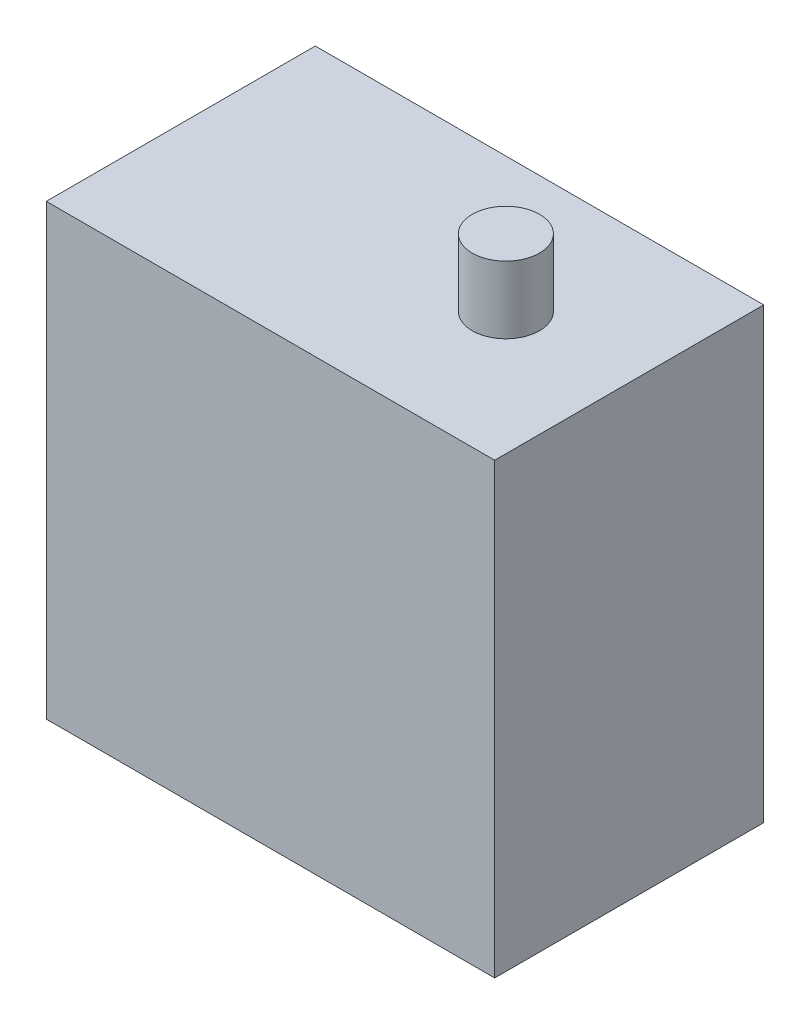
from build123d import *

# Parameters (mm, degrees)
SKETCH1_W           = 20
SKETCH1_H           = 12
BOSS_EXTRUDE1_DEPTH = 20
SKETCH2_R           = 1.5
BOSS_EXTRUDE2_DEPTH = 3


with BuildPart() as part:
    # Sketch1 → Boss-Extrude1 (new body)
    with BuildSketch(Plane(origin=(0, 0, 0), x_dir=(1, 0, 0), z_dir=(0, 1, 0))):
        Rectangle(SKETCH1_W, SKETCH1_H)
    extrude(amount=BOSS_EXTRUDE1_DEPTH)

    # Sketch2 → Boss-Extrude2 (add)
    with BuildSketch(Plane(origin=(0, 20, 0), x_dir=(1, 0, 0), z_dir=(0, 1, 0))):
        with Locations(Location((4.5, 0, 0), (0, 0, 270))):
            Circle(SKETCH2_R)
    extrude(amount=BOSS_EXTRUDE2_DEPTH)


solid = part.part
